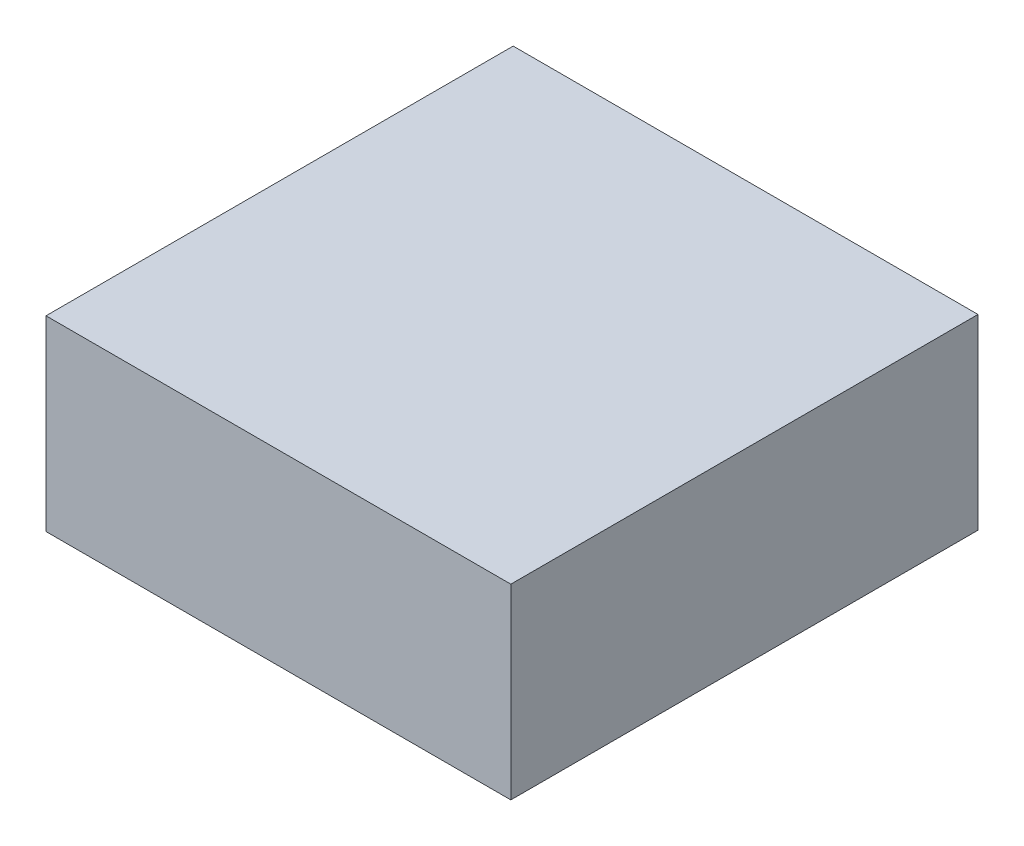
from build123d import *

# Parameters (mm, degrees)
ESQUISSE1_W        = 19.9
ESQUISSE1_H        = 8
BOSS_EXTRU_1_DEPTH = 10


with BuildPart() as part:
    # Esquisse1 → Boss.-Extru.1 (new, symmetric)
    with BuildSketch(Plane.XY):
        with Locations((0, 4)):
            Rectangle(ESQUISSE1_W, ESQUISSE1_H)
    extrude(amount=BOSS_EXTRU_1_DEPTH, both=True)


solid = part.part
